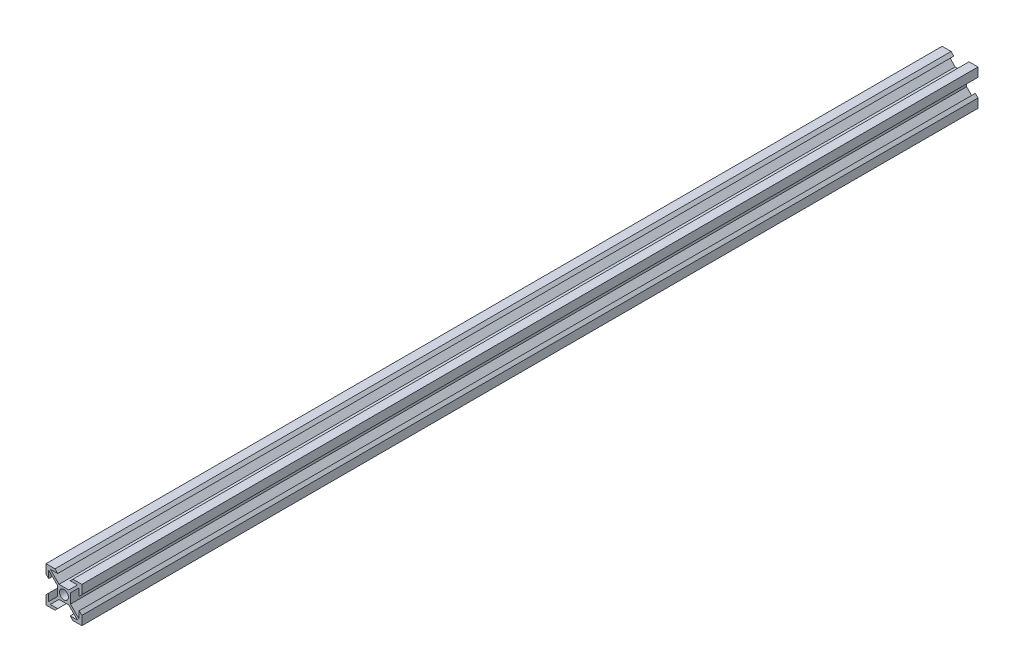
from build123d import *

# Parameters (mm, degrees)
EXTRUDE_1_DEPTH     = 500
SKETCH_2_R          = 2.5
CUT_EXTRUDE_1_DEPTH = 501.799361022


with BuildPart() as part:
    # 草图1 → 凸台-拉伸1 (new body)
    with BuildSketch(Plane.XY):
        Polygon((0, 0), (5, 0), (6.5, 1.5), (2.419238816, 1.5), (7.269238816, 6.35), (12.730761184, 6.35), (17.580761184, 1.5), (13.5, 1.5), (15, 0), (20, 0), (20, 5), (18.5, 6.5), (18.5, 2.419238816), (13.65, 7.269238816), (13.65, 12.730761184), (18.5, 17.580761184), (18.5, 13.5), (20, 15), (20, 20), (15, 20), (13.5, 18.5), (17.580761184, 18.5), (12.730761184, 13.65), (7.269238816, 13.65), (2.419238816, 18.5), (6.5, 18.5), (5, 20), (0, 20), (0, 15), (1.5, 13.5), (1.5, 17.580761184), (6.35, 12.730761184), (6.35, 7.269238816), (1.5, 2.419238816), (1.5, 6.5), (0, 5), align=None)
    extrude(amount=EXTRUDE_1_DEPTH)

    # 草图2 → 切除-拉伸1 (cut, through all)
    with BuildSketch(Plane(origin=(0, 0, 0), x_dir=(-1, 0, 0), z_dir=(0, 0, -1))):
        with Locations((-10, 10)):
            Circle(SKETCH_2_R)
    extrude(amount=-CUT_EXTRUDE_1_DEPTH, mode=Mode.SUBTRACT)


solid = part.part
